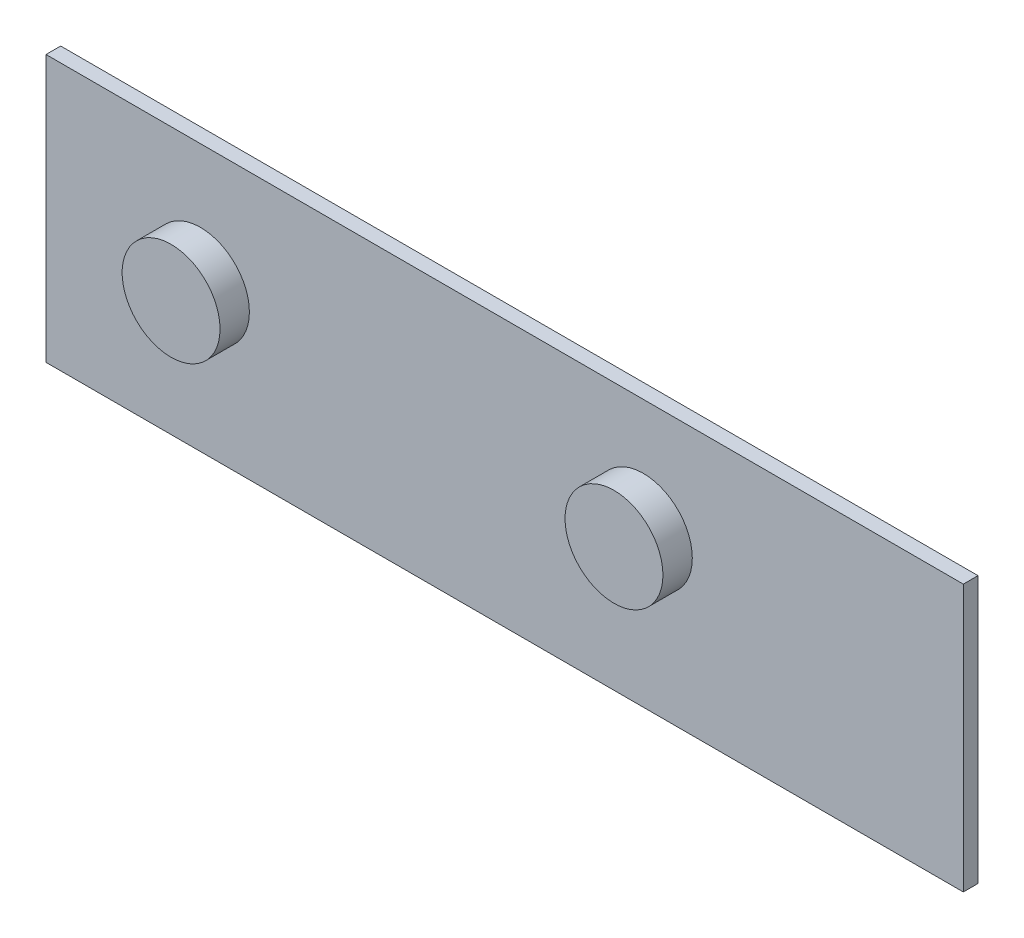
from build123d import *

# Parameters (mm, degrees)
SKETCH1_W           = 187.438016529
SKETCH1_H           = 54.483471074
BOSS_EXTRUDE1_DEPTH = 3
SKETCH2_R           = 10
BOSS_EXTRUDE2_DEPTH = 6


with BuildPart() as part:
    # Sketch1 → Boss-Extrude1 (new body)
    with BuildSketch(Plane.XY):
        with Locations((24.509256976, 27.241735537)):
            Rectangle(SKETCH1_W, SKETCH1_H)
    extrude(amount=BOSS_EXTRUDE1_DEPTH)

    # Sketch2 → Boss-Extrude2 (add)
    with BuildSketch(Plane.XY.offset(3)):
        with Locations((-37.650129612, 29.675020527)):
            Circle(SKETCH2_R)
        with Locations((52.849870388, 31.392633461)):
            Circle(SKETCH2_R)
    extrude(amount=BOSS_EXTRUDE2_DEPTH)


solid = part.part
